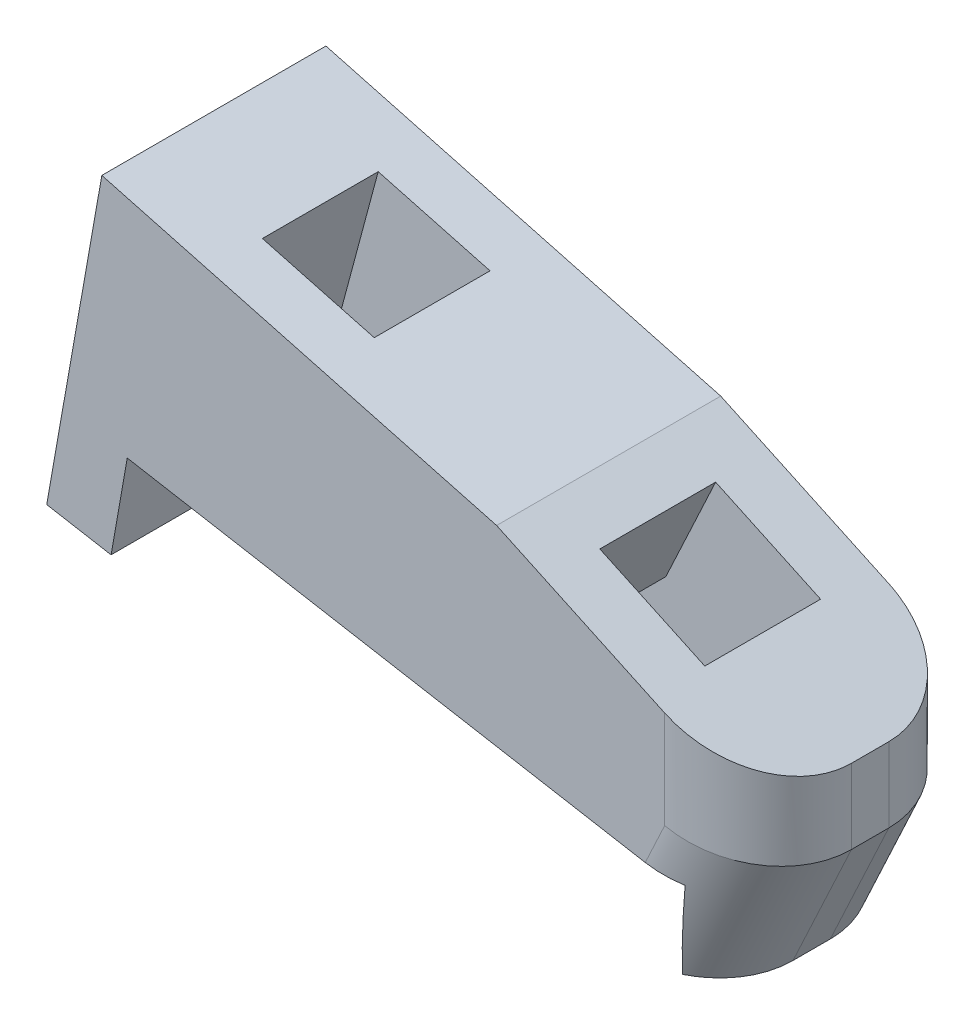
from build123d import *

# Parameters (mm, degrees)
BOSS_EXTRUDE1_DEPTH      = 6
BOSS_EXTRUDE1_DEPTH_BACK = 6
SKETCH2_W                = 6.2
SKETCH2_H                = 6.2
CUT_EXTRUDE1_DEPTH       = 3.25
SKETCH3_W                = 6.2
SKETCH3_H                = 6.2
CUT_EXTRUDE2_DEPTH       = 3.25
SKETCH4_W                = 6.2
SKETCH4_H                = 6.2
CUT_EXTRUDE3_DEPTH       = 3.25
FILLET1_R                = 5
SKETCH5_W                = 6.2
SKETCH5_H                = 6.2
CUT_EXTRUDE4_DEPTH       = 38.489999943
SKETCH6_W                = 6.2
SKETCH6_H                = 6.2
CUT_EXTRUDE5_DEPTH       = 32.982302651


with BuildPart() as part:
    # Sketch1 → Boss-Extrude1 (new, two sides: drawn at the far end of the back side and taken through both)
    with BuildSketch(Plane.XY.offset(-BOSS_EXTRUDE1_DEPTH_BACK)):
        Polygon((5.901614565, 38.174412444), (2.949595544, 21.432680643), (6.39642268, 20.824912021), (7.264663568, 25.748950786), (36.808896158, 20.539505456), (35.94065527, 15.615466691), (37.910270776, 15.268170336), (41.040910113, 21.981848059), (41.040910113, 25.981848059), (27.040910113, 32.510155273), align=None)
    extrude(amount=BOSS_EXTRUDE1_DEPTH + BOSS_EXTRUDE1_DEPTH_BACK)

    # Sketch2 → Cut-Extrude1 (cut)
    with BuildSketch(Plane(origin=(4.622386329, 26.214855554, 0), x_dir=(0.9848077530122067, -0.17364817766693813, 0), z_dir=(-0.17364817766693813, -0.9848077530122067, 0))):
        with Locations((8.183038624, 0)):
            Rectangle(SKETCH2_W, SKETCH2_H)
        with Locations((23.183038624, 0)):
            Rectangle(SKETCH2_W, SKETCH2_H)
    extrude(amount=-CUT_EXTRUDE1_DEPTH, mode=Mode.SUBTRACT)

    # Sketch3 → Cut-Extrude2 (cut)
    with BuildSketch(Plane(origin=(9.938936325, 37.092615339, 0), x_dir=(0.9659258262890682, -0.25881904510252135, 0), z_dir=(0.2588190451025213, 0.9659258262890681, 0))):
        with Locations((4.820256949, 0)):
            Rectangle(SKETCH3_W, SKETCH3_H)
    extrude(amount=-CUT_EXTRUDE2_DEPTH, mode=Mode.SUBTRACT)

    # Sketch4 → Cut-Extrude3 (cut)
    with BuildSketch(Plane(origin=(17.281785965, 37.0609096, 0), x_dir=(0.9063077870366484, -0.42261826174070294, 0), z_dir=(0.42261826174070294, 0.9063077870366484, 0))):
        with Locations((16.768002093, 0)):
            Rectangle(SKETCH4_W, SKETCH4_H)
    extrude(amount=-CUT_EXTRUDE3_DEPTH, mode=Mode.SUBTRACT)

    # Fillet1
    fillet1_edges = [part.edges().sort_by_distance(p)[0] for p in [
        (39.475590445, 18.625009197, -6),
        (41.040910113, 23.981848059, -6),
        (39.475590445, 18.625009197, 6),
        (41.040910113, 23.981848059, 6),
    ]]
    fillet(fillet1_edges, radius=FILLET1_R)

    # Sketch5 → Cut-Extrude4 (cut, through all)
    with BuildSketch(Plane(origin=(9.097774429, 33.953356403, 0), x_dir=(0.9659258262890683, -0.2588190451025211, 0), z_dir=(0.2588190451025211, 0.9659258262890683, 0))):
        with Locations((4.820256949, 0)):
            Rectangle(SKETCH5_W, SKETCH5_H)
    extrude(amount=-CUT_EXTRUDE4_DEPTH, mode=Mode.SUBTRACT)

    # Sketch6 → Cut-Extrude5 (cut, through all)
    with BuildSketch(Plane(origin=(15.908276614, 34.115409292, 0), x_dir=(0.9063077870366483, -0.42261826174070316, 0), z_dir=(0.42261826174070316, 0.9063077870366483, 0))):
        with Locations((16.768002093, 0)):
            Rectangle(SKETCH6_W, SKETCH6_H)
    extrude(amount=-CUT_EXTRUDE5_DEPTH, mode=Mode.SUBTRACT)


solid = part.part
